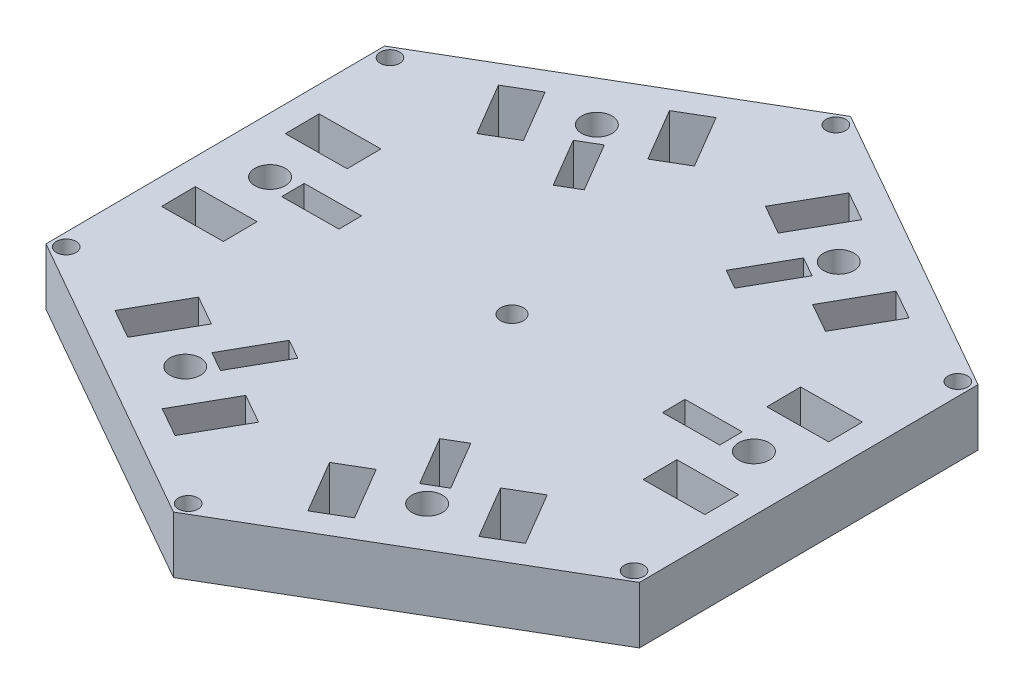
from build123d import *

# Parameters (mm, degrees)
SKETCH1_R           = 1.7
SKETCH1_R_2         = 1.0922
SKETCH1_R_3         = 1.27
BOSS_EXTRUDE1_DEPTH = 6.35


with BuildPart() as part:
    # Sketch1 → Boss-Extrude1 (new body)
    with BuildSketch(Plane(origin=(0, 0, 0), x_dir=(1, 0, 0), z_dir=(0, 1, 0))):
        Polygon((33.108066621, -18.853803983), (32.881906518, 19.245524772), (-0.226160103, 38.099328755), (-33.108066621, 18.853803983), (-32.881906518, -19.245524772), (0.226160103, -38.099328755), align=None)
        Polygon((17.921026369, 1.429624434), (24.27077465, 1.48616446), (24.29339066, -1.053734852), (17.94364238, -1.110274878), align=None, mode=Mode.SUBTRACT)
        Polygon((10.198604263, -14.805251881), (13.422443502, -20.276025186), (11.234134179, -21.565560882), (8.01029494, -16.094787576), align=None, mode=Mode.SUBTRACT)
        Polygon((-7.722422107, -16.234876315), (-10.848331148, -21.762189646), (-13.059256481, -20.51182603), (-9.933347439, -14.984512698), align=None, mode=Mode.SUBTRACT)
        Polygon((-17.921026369, -1.429624434), (-24.27077465, -1.48616446), (-24.29339066, 1.053734852), (-17.94364238, 1.110274878), align=None, mode=Mode.SUBTRACT)
        Polygon((-10.198604263, 14.805251881), (-13.422443502, 20.276025186), (-11.234134179, 21.565560882), (-8.01029494, 16.094787576), align=None, mode=Mode.SUBTRACT)
        Polygon((7.722422107, 16.234876315), (10.848331148, 21.762189646), (13.059256481, 20.51182603), (9.933347439, 14.984512698), align=None, mode=Mode.SUBTRACT)
        Polygon((-19.191887032, -15.876365047), (-15.875499033, -17.751910472), (-19.251480798, -23.72140887), (-22.567868797, -21.845863445), align=None, mode=Mode.SUBTRACT)
        with Locations((-13.204157431, -23.347933171)):
            Circle(SKETCH1_R, mode=Mode.SUBTRACT)
        Polygon((-7.031797703, -22.753364938), (-3.715409704, -24.628910363), (-7.091391469, -30.598408761), (-10.407779468, -28.722863336), align=None, mode=Mode.SUBTRACT)
        with Locations((-31.452098576, -18.420024772)):
            Circle(SKETCH1_R_2, mode=Mode.SUBTRACT)
        Polygon((-23.22089091, -5.286967024), (-23.186966894, -9.096815993), (-30.044695037, -9.15787922), (-30.078619053, -5.348030252), align=None, mode=Mode.SUBTRACT)
        with Locations((-26.821981967, -0.238830814)):
            Circle(SKETCH1_R, mode=Mode.SUBTRACT)
        with Locations((0.226160103, -36.448328755)):
            Circle(SKETCH1_R_2, mode=Mode.SUBTRACT)
        Polygon((4.153391934, -24.55884424), (7.435855918, -22.624540696), (10.917602296, -28.532975866), (7.635138312, -30.46727941), align=None, mode=Mode.SUBTRACT)
        with Locations((13.617824536, -23.109102356)):
            Circle(SKETCH1_R, mode=Mode.SUBTRACT)
        Polygon((16.189093207, -17.466397914), (19.47155719, -15.532094371), (22.953303568, -21.440529541), (19.670839585, -23.374833084), align=None, mode=Mode.SUBTRACT)
        with Locations((31.678258679, -18.028303983)):
            Circle(SKETCH1_R_2, mode=Mode.SUBTRACT)
        Polygon((23.345278966, -8.682479193), (23.311354951, -4.872630224), (30.169083094, -4.811566997), (30.203007109, -8.621415965), align=None, mode=Mode.SUBTRACT)
        Polygon((-23.345278966, 8.682479193), (-23.311354951, 4.872630224), (-30.169083094, 4.811566997), (-30.203007109, 8.621415965), align=None, mode=Mode.SUBTRACT)
        with Locations((-31.678258679, 18.028303983)):
            Circle(SKETCH1_R_2, mode=Mode.SUBTRACT)
        Polygon((30.044695037, 9.15787922), (30.078619053, 5.348030252), (23.22089091, 5.286967024), (23.186966894, 9.096815993), align=None, mode=Mode.SUBTRACT)
        with Locations((31.452098576, 18.420024772)):
            Circle(SKETCH1_R_2, mode=Mode.SUBTRACT)
        Polygon((7.031797703, 22.753364938), (3.715409704, 24.628910363), (7.091391469, 30.598408761), (10.407779468, 28.722863336), align=None, mode=Mode.SUBTRACT)
        with Locations((13.204157431, 23.347933171)):
            Circle(SKETCH1_R, mode=Mode.SUBTRACT)
        Polygon((19.191887032, 15.876365047), (15.875499033, 17.751910472), (19.251480798, 23.72140887), (22.567868797, 21.845863445), align=None, mode=Mode.SUBTRACT)
        Polygon((-16.189093207, 17.466397914), (-19.47155719, 15.532094371), (-22.953303568, 21.440529541), (-19.670839585, 23.374833084), align=None, mode=Mode.SUBTRACT)
        with Locations((-13.617824536, 23.109102356)):
            Circle(SKETCH1_R, mode=Mode.SUBTRACT)
        Polygon((-7.435855918, 22.624540696), (-10.917602296, 28.532975866), (-7.635138312, 30.46727941), (-4.153391934, 24.55884424), align=None, mode=Mode.SUBTRACT)
        with Locations((-0.226160103, 36.448328755)):
            Circle(SKETCH1_R_2, mode=Mode.SUBTRACT)
        with Locations((26.821981967, 0.238830814)):
            Circle(SKETCH1_R, mode=Mode.SUBTRACT)
        Circle(SKETCH1_R_3, mode=Mode.SUBTRACT)
    extrude(amount=-BOSS_EXTRUDE1_DEPTH)


solid = part.part
